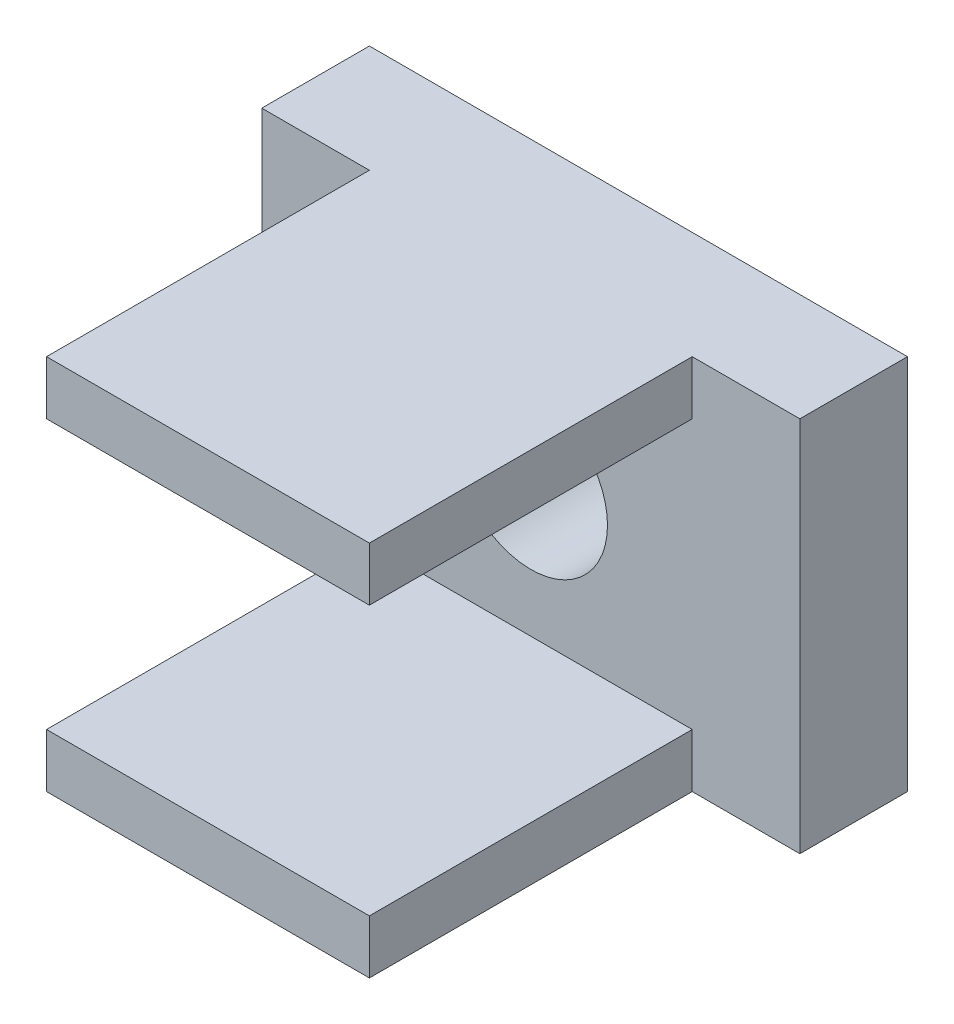
from build123d import *

# Parameters (mm, degrees)
SKETCH1_W           = 10
SKETCH1_H           = 7
BOSS_EXTRUDE1_DEPTH = 1
SKETCH2_W           = 6
SKETCH2_H           = 1
BOSS_EXTRUDE2_DEPTH = 6
SKETCH3_R           = 1.425
CUT_EXTRUDE1_DEPTH  = 9.558621384


with BuildPart() as part:
    # Sketch1 → Boss-Extrude1 (new, symmetric)
    with BuildSketch(Plane.XY):
        Rectangle(SKETCH1_W, SKETCH1_H)
    extrude(amount=BOSS_EXTRUDE1_DEPTH, both=True)

    # Sketch2 → Boss-Extrude2 (add)
    with BuildSketch(Plane.XY.offset(1)):
        with Locations((0, 3)):
            Rectangle(SKETCH2_W, SKETCH2_H)
    boss_extrude2 = extrude(amount=BOSS_EXTRUDE2_DEPTH)

    # Mirror1: Boss-Extrude2 across plane
    add(boss_extrude2.mirror(Plane.ZX))

    # Sketch3 → Cut-Extrude1 (cut, through all)
    with BuildSketch(Plane.XY.offset(1)):
        Circle(SKETCH3_R)
    extrude(amount=-CUT_EXTRUDE1_DEPTH, mode=Mode.SUBTRACT)


solid = part.part
